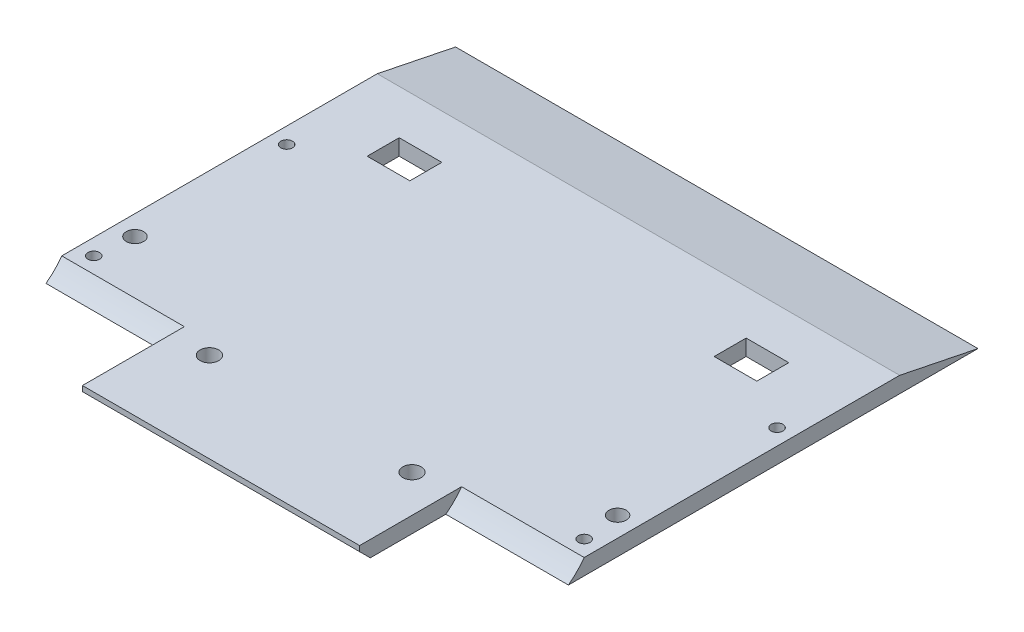
from build123d import *

# Parameters (mm, degrees)
SALIENTE_EXTRUIR1_DEPTH = 3
CORTAR_EXTRUIR1_DEPTH   = 102
SALIENTE_EXTRUIR2_DEPTH = 98
CORTAR_EXTRUIR2_DEPTH   = 23
CORTAR_EXTRUIR3_START   = -75
CORTAR_EXTRUIR3_DEPTH   = 23
CHAFL_N1_SIZE           = 2
CROQUIS3_R              = 1.1
CORTAR_EXTRUIR4_DEPTH   = 23
CROQUIS5_R              = 1.75
CORTAR_EXTRUIR5_DEPTH   = 52
CROQUIS6_R              = 1.624451876
CORTAR_EXTRUIR6_DEPTH   = 4
CROQUIS7_R              = 1.624451876
CORTAR_EXTRUIR7_DEPTH   = 4
CROQUIS8_W              = 8
CROQUIS8_H              = 6
CORTAR_EXTRUIR8_DEPTH   = 4


with BuildPart() as part:
    # Croquis1 → Saliente-Extruir1 (new body)
    with BuildSketch(Plane(origin=(0, 0, 0), x_dir=(1, 0, 0), z_dir=(0, 1, 0))):
        Polygon((51.111271676, 38.095375723), (-46.888728324, 38.095375723), (-46.888728324, -36.904624277), (-23.888728324, -36.904624277), (-23.888728324, -54.904624277), (28.111271676, -54.904624277), (28.111271676, -36.904624277), (51.111271676, -36.904624277), align=None)
    extrude(amount=SALIENTE_EXTRUIR1_DEPTH)

    # Croquis2 → Cortar-Extruir1 (cut)
    with BuildSketch(Plane.ZY.offset(46.888728324)):
        Polygon((-38.095375723, 3), (-38.095375723, 0), (-23.398437266, 3), align=None)
    extrude(amount=-CORTAR_EXTRUIR1_DEPTH, mode=Mode.SUBTRACT)

    # Croquis2<4> → Saliente-Extruir2 (add)
    with BuildSketch(Plane.ZY.offset(46.888728324)):
        with BuildLine():
            Line((36.904624277, 1.635706113), (36.904624277, 0))
            Line((36.904624277, 0), (38.738229724, 0))
            ThreePointArc((38.738229724, 0), (37.784681493, 0.776661817), (36.904624277, 1.635706113))
        make_face()
    extrude(amount=-SALIENTE_EXTRUIR2_DEPTH)

    # Croquis2<5> → Cortar-Extruir2 (cut)
    with BuildSketch(Plane.ZY.offset(46.888728324)):
        with BuildLine():
            ThreePointArc((35.783023673, 3), (36.321816168, 2.299760203), (36.904624277, 1.635706113))
            Line((36.904624277, 1.635706113), (36.904624277, 2.693376137))
            ThreePointArc((36.904624277, 2.693376137), (36.779988068, 2.845753154), (36.657673511, 3))
            Line((36.657673511, 3), (35.783023673, 3))
        make_face()
        with BuildLine():
            ThreePointArc((36.657673511, 3), (36.779988068, 2.845753154), (36.904624277, 2.693376137))
            Line((36.904624277, 2.693376137), (36.904624277, 3))
            Line((36.904624277, 3), (36.657673511, 3))
        make_face()
    extrude(amount=-CORTAR_EXTRUIR2_DEPTH, mode=Mode.SUBTRACT)

    # Croquis2<6> → Cortar-Extruir3 (cut)
    with BuildSketch(Plane.ZY.offset(46.888728324).offset(CORTAR_EXTRUIR3_START)):
        with BuildLine():
            ThreePointArc((35.783023673, 3), (36.321816168, 2.299760203), (36.904624277, 1.635706113))
            Line((36.904624277, 1.635706113), (36.904624277, 2.693376137))
            ThreePointArc((36.904624277, 2.693376137), (36.779988068, 2.845753154), (36.657673511, 3))
            Line((36.657673511, 3), (35.783023673, 3))
        make_face()
        with BuildLine():
            ThreePointArc((36.657673511, 3), (36.779988068, 2.845753154), (36.904624277, 2.693376137))
            Line((36.904624277, 2.693376137), (36.904624277, 3))
            Line((36.904624277, 3), (36.657673511, 3))
        make_face()
    extrude(amount=-CORTAR_EXTRUIR3_DEPTH, mode=Mode.SUBTRACT)

    # Chaflán1
    chafl_n1_edges = [part.edges().sort_by_distance(p)[0] for p in [
        (2.111271676, 0, 54.904624277),
    ]]
    chamfer(chafl_n1_edges, length=CHAFL_N1_SIZE)

    # Croquis3 → Cortar-Extruir4 (cut)
    with BuildSketch(Plane(origin=(0, 3, 0), x_dir=(1, 0, 0), z_dir=(0, 1, 0))):
        with Locations(Location((-43.888728324, 3.398437266, 0), (0, 0, 270))):
            Circle(CROQUIS3_R)
        with Locations(Location((-43.888728324, -32.783023673, 0), (0, 0, 270))):
            Circle(CROQUIS3_R)
        with Locations(Location((48.111271676, -32.783023673, 0), (0, 0, 270))):
            Circle(CROQUIS3_R)
        with Locations(Location((48.111271676, 3.398437266, 0), (0, 0, 270))):
            Circle(CROQUIS3_R)
    extrude(amount=-CORTAR_EXTRUIR4_DEPTH, mode=Mode.SUBTRACT)

    # Croquis5 → Cortar-Extruir5 (cut)
    with BuildSketch(Plane(origin=(0, 3, 0), x_dir=(1, 0, 0), z_dir=(0, 1, 0))):
        with Locations(Location((-16.888728324, -38.081562734, 0), (0, 0, 270))):
            Circle(CROQUIS5_R)
        with Locations(Location((21.111271676, -38.081562734, 0), (0, 0, 270))):
            Circle(CROQUIS5_R)
    extrude(amount=-CORTAR_EXTRUIR5_DEPTH, mode=Mode.SUBTRACT)

    # Croquis6 → Cortar-Extruir6 (cut)
    with BuildSketch(Plane(origin=(0, 3, 0), x_dir=(1, 0, 0), z_dir=(0, 1, 0))):
        with Locations(Location((47.381271676, -25.781562734, 0), (0, 0, 270))):
            Circle(CROQUIS6_R)
    extrude(amount=-CORTAR_EXTRUIR6_DEPTH, mode=Mode.SUBTRACT)

    # Croquis7 → Cortar-Extruir7 (cut)
    with BuildSketch(Plane(origin=(0, 3, 0), x_dir=(1, 0, 0), z_dir=(0, 1, 0))):
        with Locations(Location((-43.158728324, -25.781562734, 0), (0, 0, 270))):
            Circle(CROQUIS7_R)
    extrude(amount=-CORTAR_EXTRUIR7_DEPTH, mode=Mode.SUBTRACT)

    # Croquis8 → Cortar-Extruir8 (cut)
    with BuildSketch(Plane(origin=(0, 3, 0), x_dir=(1, 0, 0), z_dir=(0, 1, 0))):
        with Locations((-30.432234651, 12.05730105)):
            Rectangle(CROQUIS8_W, CROQUIS8_H)
        with Locations((34.654778004, 12.05730105)):
            Rectangle(CROQUIS8_W, CROQUIS8_H)
    extrude(amount=-CORTAR_EXTRUIR8_DEPTH, mode=Mode.SUBTRACT)


solid = part.part
